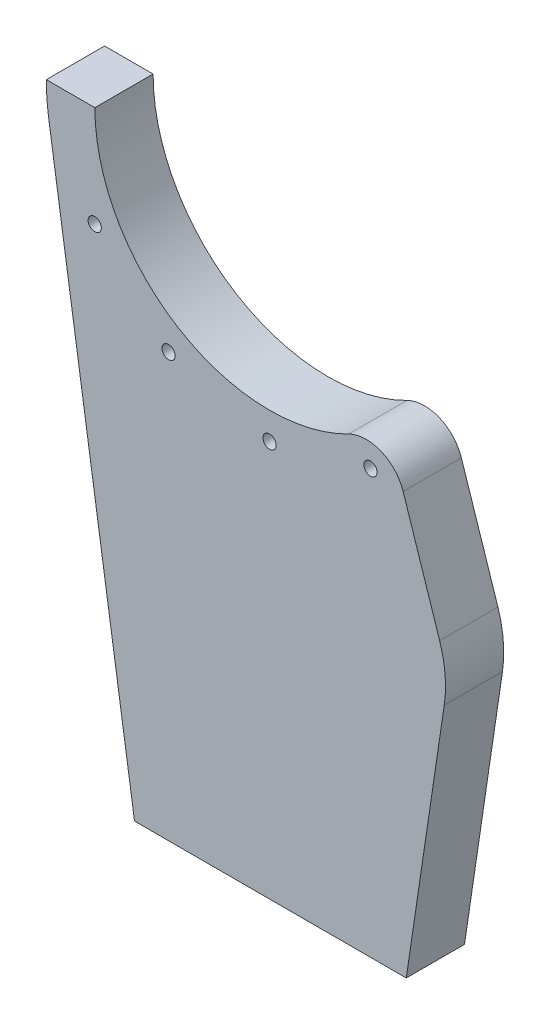
from build123d import *

# Parameters (mm, degrees)
SKETCH1_R           = 1.7
BOSS_EXTRUDE1_DEPTH = 15
FILLET1_R           = 10
FILLET2_R           = 30


with BuildPart() as part:
    # Sketch1 → Boss-Extrude1 (new body)
    with BuildSketch(Plane.XY):
        with BuildLine():
            Line((-57.5, 0), (-45, 0))
            ThreePointArc((-45, 0), (-18.212102581, -41.149961356), (30.258636425, -33.307880775))
            Line((30.258636425, -33.307880775), (46.0437747, -81.254716073))
            Line((46.0437747, -81.254716073), (35.213577586, -154.047675233))
            Line((35.213577586, -154.047675233), (-34.786422414, -154.047675233))
            Line((-34.786422414, -154.047675233), (-56.849444808, -8.625))
            ThreePointArc((-56.849444808, -8.625), (-57.337130537, -4.324749908), (-57.5, 0))
        make_face()
        with Locations((0, -52)):
            Circle(SKETCH1_R, mode=Mode.SUBTRACT)
        with Locations((-26, -45.033320997)):
            Circle(SKETCH1_R, mode=Mode.SUBTRACT)
        with Locations((-45.033320997, -26)):
            Circle(SKETCH1_R, mode=Mode.SUBTRACT)
        with Locations((26, -45.033320997)):
            Circle(SKETCH1_R, mode=Mode.SUBTRACT)
    extrude(amount=BOSS_EXTRUDE1_DEPTH)

    # Fillet1
    fillet1_edges = [part.edges().sort_by_distance(p)[0] for p in [
        (30.258636425, -33.307880775, 7.5),
    ]]
    fillet(fillet1_edges, radius=FILLET1_R)

    # Fillet2
    fillet2_edges = [part.edges().sort_by_distance(p)[0] for p in [
        (46.0437747, -81.254716073, 7.5),
    ]]
    fillet(fillet2_edges, radius=FILLET2_R)


solid = part.part
